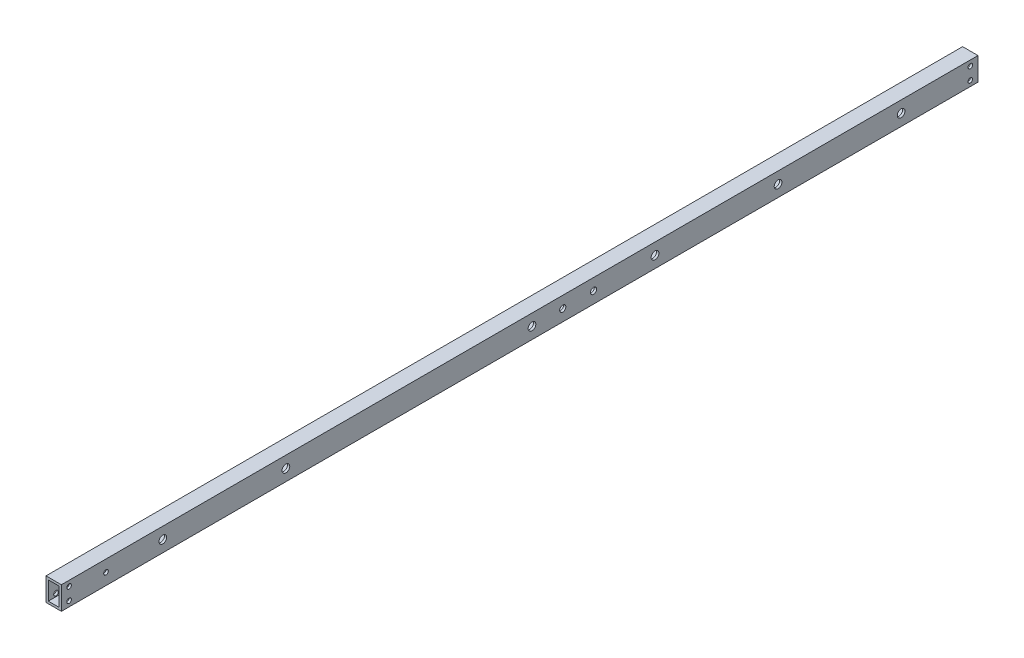
from build123d import *

# Parameters (mm, degrees)
SKETCH_1_W          = 10
SKETCH_1_H          = 15
SKETCH_1_W_2        = 7
SKETCH_1_H_2        = 12
EXTRUDE_1_DEPTH     = 596
SKETCH_2_R          = 1.5
SKETCH_2_R_2        = 2.5
SKETCH_2_R_3        = 2
CUT_EXTRUDE_1_DEPTH = 597.131067803
SKETCH_3_R          = 4
CUT_EXTRUDE_2_DEPTH = 1.5


with BuildPart() as part:
    # ｽｹｯﾁ1 → 押し出し-薄板1 (new body)
    with BuildSketch(Plane.XY):
        Rectangle(SKETCH_1_W, SKETCH_1_H)
        Rectangle(SKETCH_1_W_2, SKETCH_1_H_2, mode=Mode.SUBTRACT)
    extrude(amount=EXTRUDE_1_DEPTH)

    # ｽｹｯﾁ2 → ｶｯﾄ - 押し出し1 (cut, through all)
    with BuildSketch(Plane(origin=(5, 0, 0), x_dir=(0, 0, -1), z_dir=(1, 0, 0))):
        with Locations((-5, 4)):
            Circle(SKETCH_2_R)
        with Locations((-5, -4)):
            Circle(SKETCH_2_R)
        with Locations((-591, 4)):
            Circle(SKETCH_2_R)
        with Locations((-591, -4)):
            Circle(SKETCH_2_R)
        with Locations((-50, 0)):
            Circle(SKETCH_2_R_2)
        with Locations((-567, 0)):
            Circle(SKETCH_2_R)
        with Locations((-530, 0)):
            Circle(SKETCH_2_R_2)
        with Locations((-250, 0)):
            Circle(SKETCH_2_R_3)
        with Locations((-270, 0)):
            Circle(SKETCH_2_R_3)
        with Locations((-450, 0)):
            Circle(SKETCH_2_R_2)
        with Locations((-290, 0)):
            Circle(SKETCH_2_R_2)
        with Locations((-210, 0)):
            Circle(SKETCH_2_R_2)
        with Locations((-130, 0)):
            Circle(SKETCH_2_R_2)
    extrude(amount=-CUT_EXTRUDE_1_DEPTH, mode=Mode.SUBTRACT)

    # ｽｹｯﾁ3 → ｶｯﾄ - 押し出し2 (cut)
    with BuildSketch(Plane.ZY.offset(5)):
        with Locations((250, 0)):
            Circle(SKETCH_3_R)
        with Locations((270, 0)):
            Circle(SKETCH_3_R)
    extrude(amount=-CUT_EXTRUDE_2_DEPTH, mode=Mode.SUBTRACT)


solid = part.part
